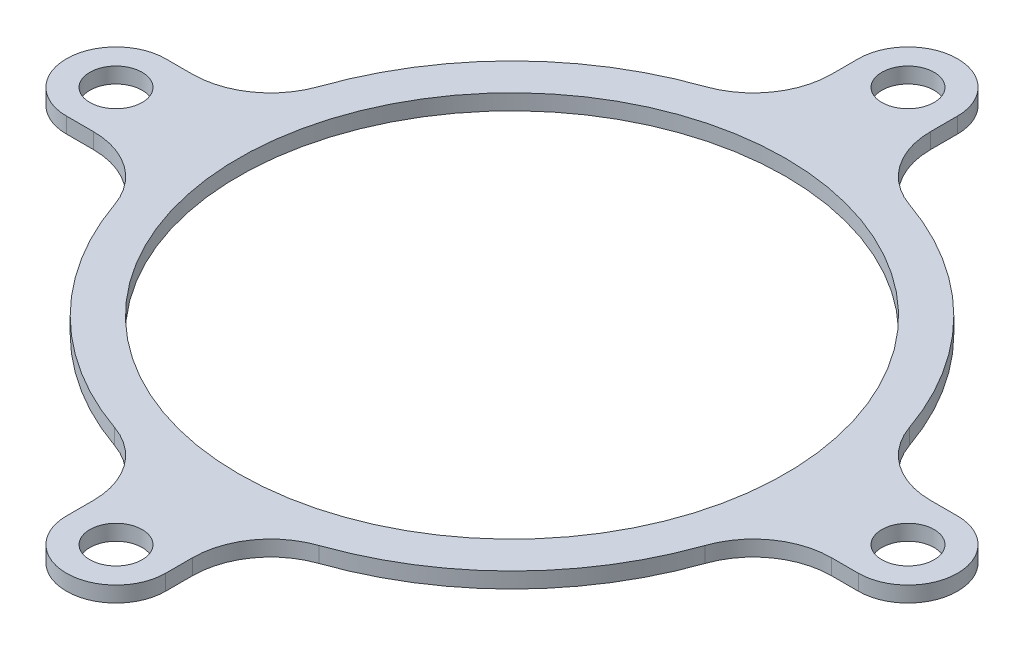
from build123d import *

# Parameters (mm, degrees)
SKETCH1_R           = 40
SKETCH1_R_2         = 35
BOSS_EXTRUDE1_DEPTH = 1
SKETCH2_R           = 3.35
BOSS_EXTRUDE2_DEPTH = 2
CIRPATTERN1_COUNT   = 4


with BuildPart() as part:
    # Sketch1 → Boss-Extrude1 (new, symmetric)
    with BuildSketch(Plane(origin=(0, 0, 0), x_dir=(1, 0, 0), z_dir=(0, 1, 0))):
        with Locations(Location((0, 0, 0), (0, 0, 270))):
            Circle(SKETCH1_R)
        with Locations(Location((0, 0, 0), (0, 0, 270))):
            Circle(SKETCH1_R_2, mode=Mode.SUBTRACT)
    extrude(amount=BOSS_EXTRUDE1_DEPTH, both=True)

    # Sketch2 → Boss-Extrude2 (add)
    with BuildSketch(Plane(origin=(0, 1, 0), x_dir=(1, 0, 0), z_dir=(0, 1, 0))):
        with BuildLine():
            Line((-6.35, 47.251216916), (-6.35, 50.7))
            ThreePointArc((-6.35, 50.7), (0, 57.05), (6.35, 50.7))
            Line((6.35, 50.7), (6.35, 47.251216916))
            ThreePointArc((6.35, 47.251216916), (8.204449067, 41.450354911), (13.08, 37.800973532))
            ThreePointArc((13.08, 37.800973532), (0, 40), (-13.08, 37.800973532))
            ThreePointArc((-13.08, 37.800973532), (-8.204449067, 41.450354911), (-6.35, 47.251216916))
        make_face()
        with Locations(Location((0, 50.7, 0), (0, 0, 270))):
            Circle(SKETCH2_R, mode=Mode.SUBTRACT)
    boss_extrude2 = extrude(amount=-BOSS_EXTRUDE2_DEPTH)

    # CirPattern1: Boss-Extrude2 ×4 about axis
    cirpattern1_axis = Axis((0, 0, 0), (0, 1, 0))
    for i in range(1, CIRPATTERN1_COUNT):
        add(boss_extrude2.rotate(cirpattern1_axis, i * 360 / CIRPATTERN1_COUNT))


solid = part.part
